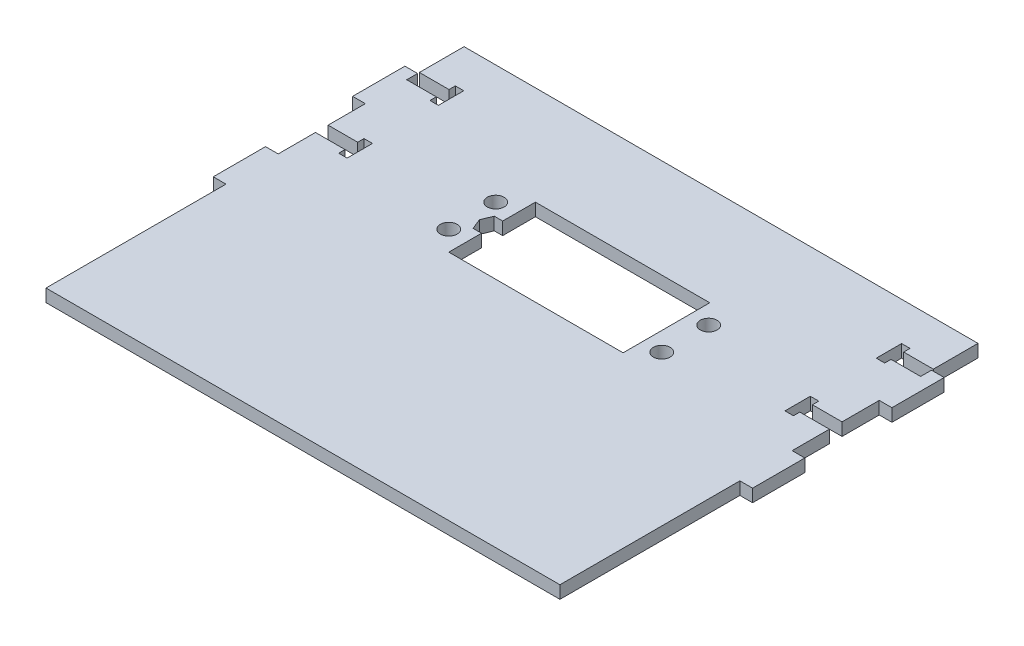
from build123d import *

# Parameters (mm, degrees)
SKETCH2_W           = 121.6
SKETCH2_H           = 98.919653249
SKETCH2_R           = 2
BOSS_EXTRUDE1_DEPTH = 3
SKETCH3_W           = 3
SKETCH3_H           = 12.364956656
BOSS_EXTRUDE2_DEPTH = 3
CUT_EXTRUDE1_DEPTH  = 101.7


with BuildPart() as part:
    # Sketch2 → Boss-Extrude1 (new body)
    with BuildSketch(Plane(origin=(0, 0, 0), x_dir=(1, 0, 0), z_dir=(0, 1, 0))):
        with Locations((20.5, -5.540173376)):
            Rectangle(SKETCH2_W, SKETCH2_H)
        Polygon((41.25, 0), (0, 0), (0, 7.75), (-2, 7.75), (-3, 10.25), (-2, 12.75), (0, 12.75), (0, 20.5), (41.25, 20.5), align=None, mode=Mode.SUBTRACT)
        with Locations(Location((-4.7, 4.7, 0), (0, 0, 270))):
            Circle(SKETCH2_R, mode=Mode.SUBTRACT)
        with Locations(Location((-4.7, 15.8, 0), (0, 0, 270))):
            Circle(SKETCH2_R, mode=Mode.SUBTRACT)
        with Locations(Location((45.7, 4.7, 0), (0, 0, 270))):
            Circle(SKETCH2_R, mode=Mode.SUBTRACT)
        with Locations(Location((45.7, 15.8, 0), (0, 0, 270))):
            Circle(SKETCH2_R, mode=Mode.SUBTRACT)
    extrude(amount=BOSS_EXTRUDE1_DEPTH)

    # Sketch3 → Boss-Extrude2 (add, through all)
    with BuildSketch(Plane(origin=(0, 0, 0), x_dir=(1, 0, 0), z_dir=(0, 1, 0))):
        with Locations((-41.8, 26.736608875)):
            Rectangle(SKETCH3_W, SKETCH3_H)
        with Locations((-41.8, -6.236608875)):
            Rectangle(SKETCH3_W, SKETCH3_H)
        with Locations((82.8, -6.236608875)):
            Rectangle(SKETCH3_W, SKETCH3_H)
        with Locations((82.8, 26.736608875)):
            Rectangle(SKETCH3_W, SKETCH3_H)
    extrude(amount=BOSS_EXTRUDE2_DEPTH)

    # Sketch4 → Cut-Extrude1 (cut, through all)
    with BuildSketch(Plane(origin=(0, 0, 0), x_dir=(1, 0, 0), z_dir=(0, 1, 0))):
        Polygon((81.3, 8.75), (74.3, 8.75), (74.3, 7.25), (72.3, 7.25), (72.3, 13.25), (74.3, 13.25), (74.3, 11.75), (81.3, 11.75), align=None)
        Polygon((81.3, 30.348544885), (74.3, 30.348544885), (74.3, 28.848544885), (72.3, 28.848544885), (72.3, 34.848544885), (74.3, 34.848544885), (74.3, 33.348544885), (81.3, 33.348544885), align=None)
        Polygon((-40.3, 30.348544885), (-40.3, 33.348544885), (-33.3, 33.348544885), (-33.3, 34.848544885), (-31.3, 34.848544885), (-31.3, 28.848544885), (-33.3, 28.848544885), (-33.3, 30.348544885), align=None)
        Polygon((-40.3, 8.75), (-40.3, 11.75), (-33.3, 11.75), (-33.3, 13.25), (-31.3, 13.25), (-31.3, 7.25), (-33.3, 7.25), (-33.3, 8.75), align=None)
    extrude(amount=CUT_EXTRUDE1_DEPTH, mode=Mode.SUBTRACT)


solid = part.part
